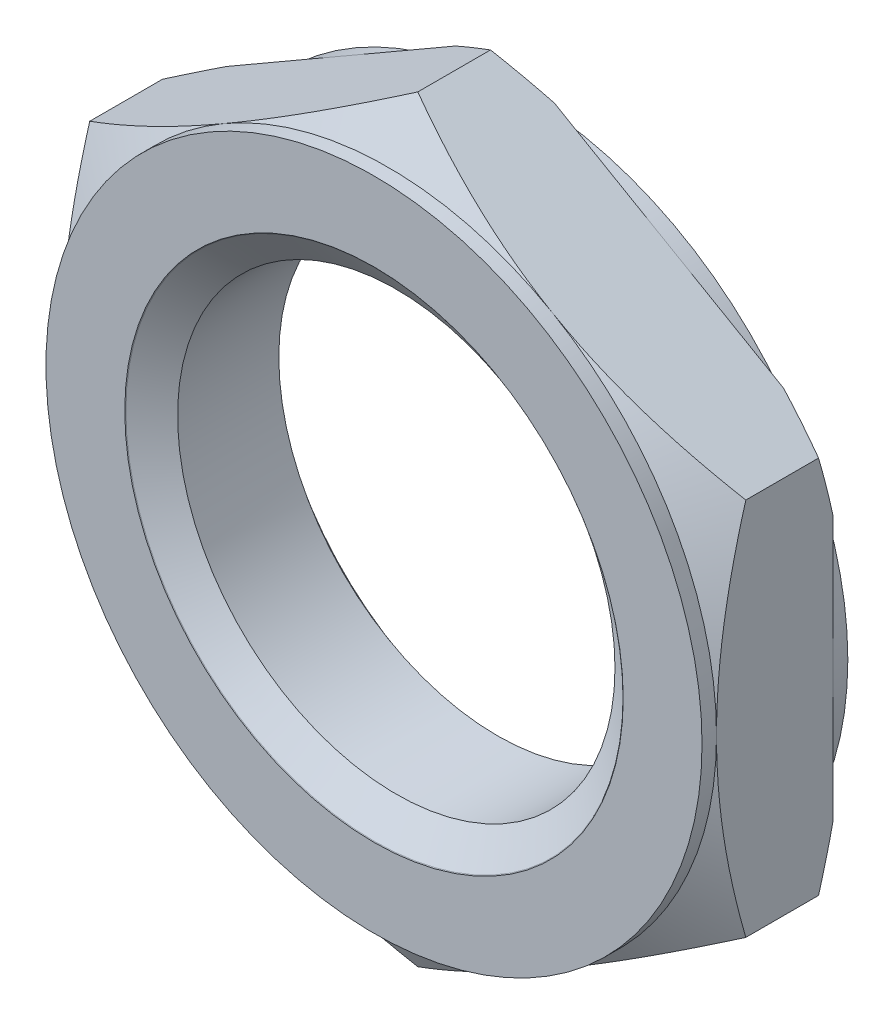
from build123d import *

# Parameters (mm, degrees)
BASENUTSKE_R       = 5.25
BASENUT_DEPTH      = 4
SKETCH4_W          = 0.4064
SKETCH4_H          = 11.392304845
SKETCH6_R          = 6
CUT_EXTRUDE1_DEPTH = 10


with BuildPart() as part:
    # BaseNutSke → BaseNut (new body)
    with BuildSketch(Plane.XY):
        Polygon((9, 5.196152423), (9, -5.196152423), (0, -10.392304845), (-9, -5.196152423), (-9, 5.196152423), (0, 10.392304845), align=None)
        Circle(BASENUTSKE_R, mode=Mode.SUBTRACT)
    extrude(amount=-BASENUT_DEPTH)

    # Sketch4 → Bearing-Face (revolve, cut)
    with BuildSketch(Plane(origin=(0, 0, 0), x_dir=(0, 0, -1), z_dir=(1, 0, 0)), mode=Mode.PRIVATE) as bearing_face_sk:
        with Locations((3.7968, 14.696152423)):
            Rectangle(SKETCH4_W, SKETCH4_H)
        Polygon((0, 9), (-10, 9), (-10, 20.392304845), (0.803847577, 20.392304845), (0.803847577, 10.392304845), align=None)
    revolve(bearing_face_sk.sketch.rotate(Axis((0, 0, 0), (0, 0, -1)), 90), axis=Axis((0, 0, 0), (0, 0, -1)), mode=Mode.SUBTRACT)

    # Sketch3 → Double-Chamfer (revolve, cut)
    with BuildSketch(Plane(origin=(0, 0, 0), x_dir=(0, 0, -1), z_dir=(1, 0, 0)), mode=Mode.PRIVATE) as double_chamfer_sk:
        Polygon((4, 9), (3.196152423, 10.392304845), (3.196152423, 20.392304845), (14, 20.392304845), (14, 9), align=None)
        Polygon((1.201295155, 20.392304845), (-9.602552423, 20.392304845), (-9.602552423, 9), (0.397447577, 9), (1.201295155, 10.392304845), align=None)
    revolve(double_chamfer_sk.sketch.rotate(Axis((0, 0, 0), (0, 0, -1)), 90), axis=Axis((0, 0, 0), (0, 0, -1)), mode=Mode.SUBTRACT)

    # Sketch5 → EndChamfer (revolve, cut)
    with BuildSketch(Plane(origin=(0, 0, 0), x_dir=(0, 0, -1), z_dir=(1, 0, 0)), mode=Mode.PRIVATE) as endchamfer_sk:
        Polygon((3.9746, 6.8375), (2.751862586, 5.09125), (4.0254, 5.09125), (4.0254, 6.8375), align=None)
        Polygon((-0.0508, 6.8375), (0, 6.8375), (1.222737414, 5.09125), (-0.0508, 5.09125), align=None)
    revolve(endchamfer_sk.sketch.rotate(Axis((0, 0, -25.037505729), (0, 0, -1)), 90), axis=Axis((0, 0, -25.037505729), (0, 0, -1)), mode=Mode.SUBTRACT)

    # ThdSchSke → ThreadSchematic (revolve, cut)
    with BuildSketch(Plane(origin=(0, 0, 0), x_dir=(1, 0, 0), z_dir=(0, 1, 0))):
        Polygon((-6.8375, 0.0254), (-5.25, 1.136979467), (-2.625, 1.136979467), (-2.625, -1.086179467), (-5.25, -1.086179467), align=None)
    revolve(axis=Axis((0, 0, -3.175), (0, 0, 1)), mode=Mode.SUBTRACT)

    # Sketch6 → Cut-Extrude1 (cut)
    with BuildSketch(Plane.XY):
        Circle(SKETCH6_R)
    extrude(amount=-CUT_EXTRUDE1_DEPTH, mode=Mode.SUBTRACT)


solid = part.part
